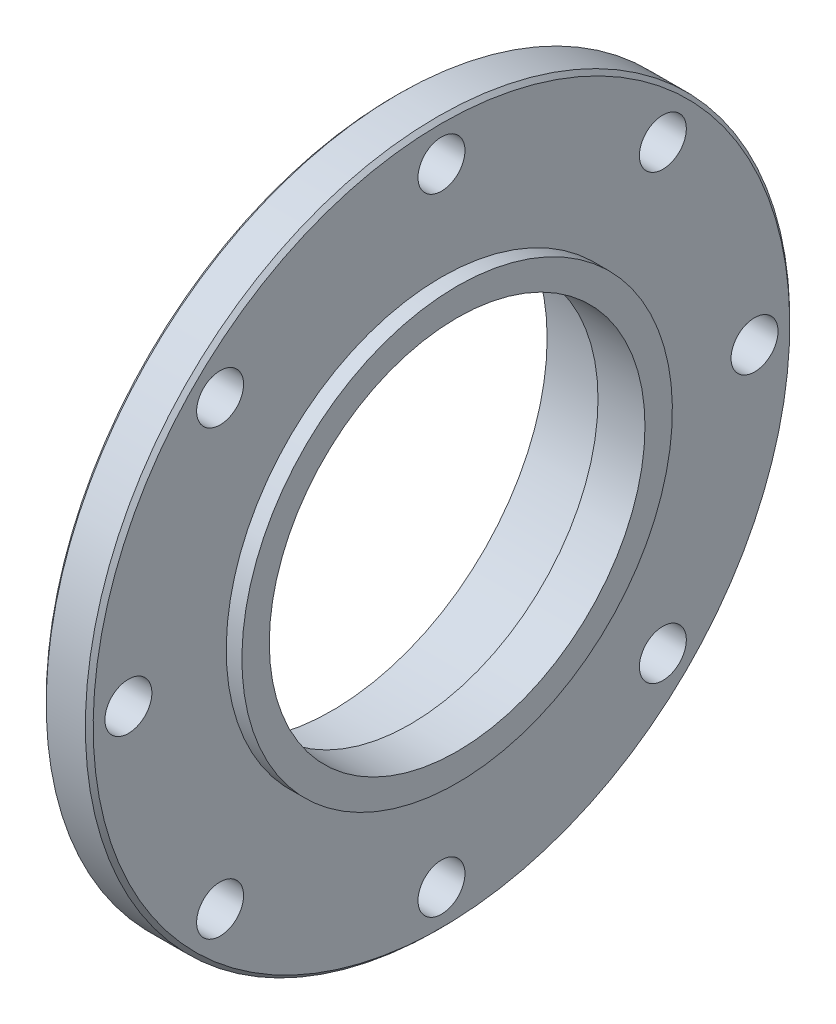
from build123d import *

# Parameters (mm, degrees)
SKETCH_3_R          = 3
CUT_EXTRUDE_1_DEPTH = 10
CHAMFER_1_SIZE      = 0.5
FILLET_1_R          = 5


with BuildPart() as part:
    # 草图1 → 旋转1 (revolve)
    with BuildSketch(Plane.XY):
        Polygon((0, 0), (0, 30), (8, 30), (8, 45), (14, 45), (14, 27.5), (16, 27.5), (16, 0), align=None)
    revolve(axis=Axis((16, 0, 0), (-1, 0, 0)))

    # 草图2 → 切除-旋转1 (revolve, cut)
    with BuildSketch(Plane.XY, mode=Mode.PRIVATE) as cut_revolve_1_sk:
        Polygon((0, 0), (0, 27.5), (10, 27.5), (10, 24), (16, 24), (16, 0), align=None)
    revolve(cut_revolve_1_sk.sketch.rotate(Axis((16, 0, 0), (-1, 0, 0)), 90), axis=Axis((16, 0, 0), (-1, 0, 0)), mode=Mode.SUBTRACT)

    # 草图3 → 切除-拉伸1 (cut)
    with BuildSketch(Plane.ZY.offset(-8)):
        with Locations(Location((0, 40, 0), (0, 0, 270))):
            Circle(SKETCH_3_R)
        with Locations(Location((28.284271247, 28.284271247, 0), (0, 0, 270))):
            Circle(SKETCH_3_R)
        with Locations(Location((40, 0, 0), (0, 0, 270))):
            Circle(SKETCH_3_R)
        with Locations(Location((28.284271247, -28.284271247, 0), (0, 0, 270))):
            Circle(SKETCH_3_R)
        with Locations(Location((0, -40, 0), (0, 0, 270))):
            Circle(SKETCH_3_R)
        with Locations(Location((-28.284271247, -28.284271247, 0), (0, 0, 270))):
            Circle(SKETCH_3_R)
        with Locations(Location((-40, 0, 0), (0, 0, 270))):
            Circle(SKETCH_3_R)
        with Locations(Location((-28.284271247, 28.284271247, 0), (0, 0, 270))):
            Circle(SKETCH_3_R)
    extrude(amount=-CUT_EXTRUDE_1_DEPTH, mode=Mode.SUBTRACT)

    # 倒角1
    chamfer_1_edges = [part.edges().sort_by_distance(p)[0] for p in [
        (14, -45, 0),
        (8, -45, 0),
        (0, -30, 0),
    ]]
    chamfer(chamfer_1_edges, length=CHAMFER_1_SIZE)

    # 圆角1
    fillet_1_edges = [part.edges().sort_by_distance(p)[0] for p in [
        (8, -30, 0),
    ]]
    fillet(fillet_1_edges, radius=FILLET_1_R)


solid = part.part
